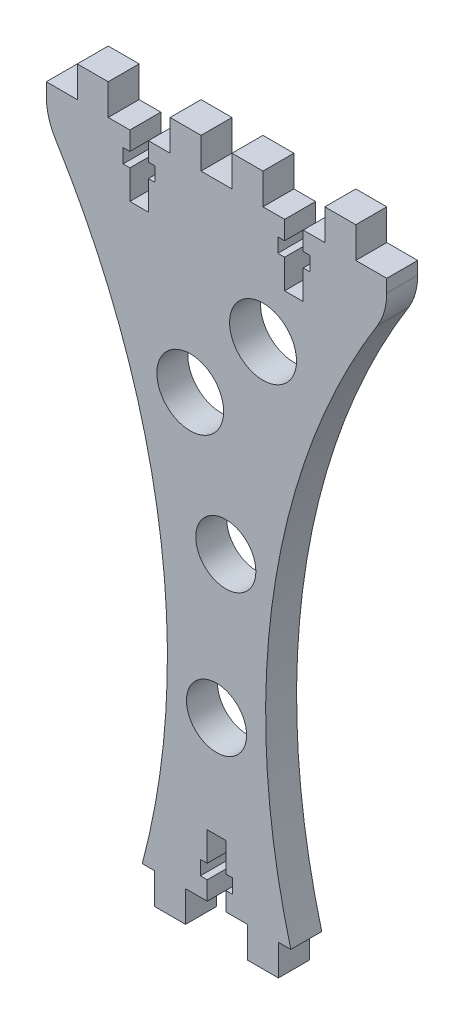
from build123d import *

# Parameters (mm, degrees)
ESQUISSE1_R        = 5.406629484
ESQUISSE1_R_2      = 5.395392345
ESQUISSE1_R_3      = 4.854658012
ESQUISSE1_R_4      = 4.85477379
BOSS_EXTRU_1_DEPTH = 5
CONG_1_R           = 10


with BuildPart() as part:
    # Esquisse1 → Boss.-Extru.1 (new body)
    with BuildSketch(Plane.XY):
        with BuildLine():
            Line((-10, 0), (-12, 0))
            ThreePointArc((-12, 0), (-9.447374533, 49.977092468), (-27.5, 96.649658093))
            Line((-27.5, 96.649658093), (-27.5, 101.649658093))
            Line((-27.5, 101.649658093), (-22.5, 101.649658093))
            Line((-22.5, 101.649658093), (-22.5, 106.649658093))
            Line((-22.5, 106.649658093), (-17.5, 106.649658093))
            Line((-17.5, 106.649658093), (-17.5, 101.649658093))
            Line((-17.5, 101.649658093), (-14, 101.649658093))
            Line((-14, 101.649658093), (-14, 98.649658093))
            Line((-14, 98.649658093), (-15.1, 98.649658093))
            Line((-15.1, 98.649658093), (-15.1, 96.349658093))
            Line((-15.1, 96.349658093), (-14, 96.349658093))
            Line((-14, 96.349658093), (-14, 91.649658093))
            Line((-14, 91.649658093), (-11, 91.649658093))
            Line((-11, 91.649658093), (-11, 96.349658093))
            Line((-11, 96.349658093), (-9.9, 96.349658093))
            Line((-9.9, 96.349658093), (-9.9, 98.649658093))
            Line((-9.9, 98.649658093), (-11, 98.649658093))
            Line((-11, 98.649658093), (-11, 101.649658093))
            Line((-11, 101.649658093), (-7.5, 101.649658093))
            Line((-7.5, 101.649658093), (-7.5, 106.649658093))
            Line((-7.5, 106.649658093), (-2.5, 106.649658093))
            Line((-2.5, 106.649658093), (-2.5, 101.649658093))
            Line((-2.5, 101.649658093), (2.5, 101.649658093))
            Line((2.5, 101.649658093), (2.5, 106.649658093))
            Line((2.5, 106.649658093), (7.5, 106.649658093))
            Line((7.5, 106.649658093), (7.5, 101.649658093))
            Line((7.5, 101.649658093), (11, 101.649658093))
            Line((11, 101.649658093), (11, 98.649658093))
            Line((11, 98.649658093), (9.9, 98.649658093))
            Line((9.9, 98.649658093), (9.9, 96.349658093))
            Line((9.9, 96.349658093), (11, 96.349658093))
            Line((11, 96.349658093), (11, 91.649658093))
            Line((11, 91.649658093), (14, 91.649658093))
            Line((14, 91.649658093), (14, 96.349658093))
            Line((14, 96.349658093), (15.1, 96.349658093))
            Line((15.1, 96.349658093), (15.1, 98.649658093))
            Line((15.1, 98.649658093), (14, 98.649658093))
            Line((14, 98.649658093), (14, 101.649658093))
            Line((14, 101.649658093), (17.5, 101.649658093))
            Line((17.5, 101.649658093), (17.5, 106.649658093))
            Line((17.5, 106.649658093), (22.5, 106.649658093))
            Line((22.5, 106.649658093), (22.5, 101.649658093))
            Line((22.5, 101.649658093), (27.5, 101.649658093))
            Line((27.5, 101.649658093), (27.5, 96.649658093))
            ThreePointArc((27.5, 96.649658093), (9.447374533, 49.977092468), (12, 0))
            Line((12, 0), (10, 0))
            Line((10, 0), (10, -5))
            Line((10, -5), (5, -5))
            Line((5, -5), (5, 0))
            Line((5, 0), (1.5, 0))
            Line((1.5, 0), (1.5, 3))
            Line((1.5, 3), (2.6, 3))
            Line((2.6, 3), (2.6, 5.3))
            Line((2.6, 5.3), (1.5, 5.3))
            Line((1.5, 5.3), (1.5, 10))
            Line((1.5, 10), (-1.5, 10))
            Line((-1.5, 10), (-1.5, 5.3))
            Line((-1.5, 5.3), (-2.6, 5.3))
            Line((-2.6, 5.3), (-2.6, 3))
            Line((-2.6, 3), (-1.5, 3))
            Line((-1.5, 3), (-1.5, 0))
            Line((-1.5, 0), (-5, 0))
            Line((-5, 0), (-5, -5))
            Line((-5, -5), (-10, -5))
            Line((-10, -5), (-10, 0))
        make_face()
        with Locations((7.512942396, 82.788090233)):
            Circle(ESQUISSE1_R, mode=Mode.SUBTRACT)
        with Locations((-4.245332426, 69.827264576)):
            Circle(ESQUISSE1_R_2, mode=Mode.SUBTRACT)
        with Locations((1.500188226, 50.051984193)):
            Circle(ESQUISSE1_R_3, mode=Mode.SUBTRACT)
        with Locations((0, 26.401817788)):
            Circle(ESQUISSE1_R_4, mode=Mode.SUBTRACT)
    extrude(amount=BOSS_EXTRU_1_DEPTH)

    # Congé1
    cong_1_edges = [part.edges().sort_by_distance(p)[0] for p in [
        (27.5, 96.649658093, 2.5),
        (-27.5, 96.649658093, 2.5),
    ]]
    fillet(cong_1_edges, radius=CONG_1_R)


solid = part.part
